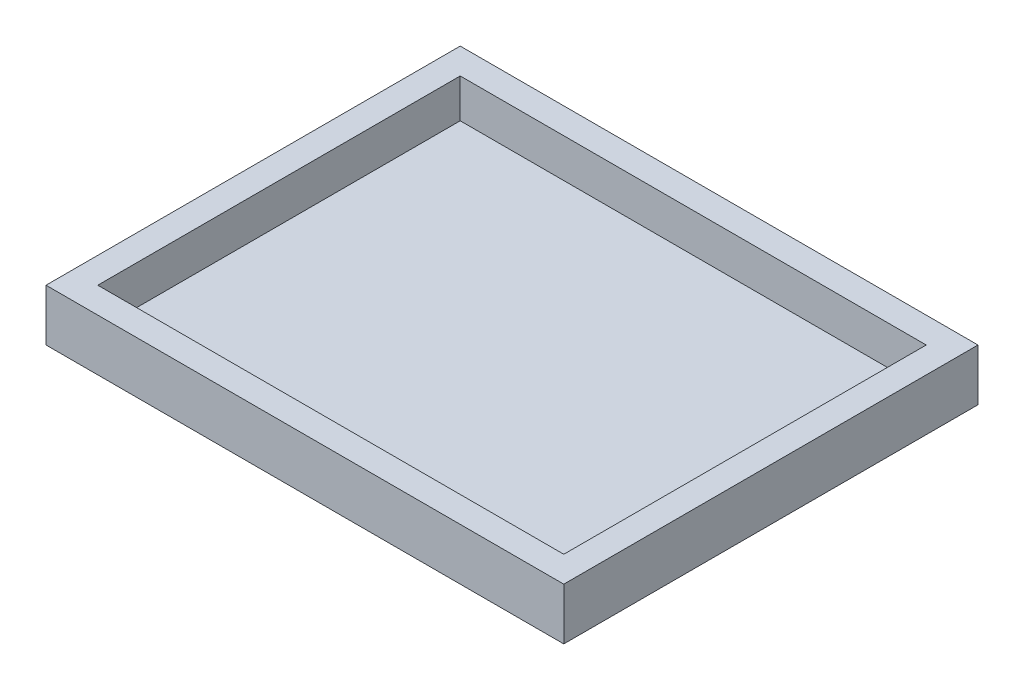
from build123d import *

# Parameters (mm, degrees)
SKETCH1_W           = 100
SKETCH1_H           = 80
SKETCH1_W_2         = 90
SKETCH1_H_2         = 70
BOSS_EXTRUDE1_DEPTH = 10
SKETCH1_2_W         = 90
SKETCH1_2_H         = 70
BOSS_EXTRUDE2_DEPTH = 2.5


with BuildPart() as part:
    # Sketch1 → Boss-Extrude1 (new body)
    with BuildSketch(Plane(origin=(0, 0, 0), x_dir=(1, 0, 0), z_dir=(0, 1, 0))):
        Rectangle(SKETCH1_W, SKETCH1_H)
        Rectangle(SKETCH1_W_2, SKETCH1_H_2, mode=Mode.SUBTRACT)
    extrude(amount=BOSS_EXTRUDE1_DEPTH)

    # Sketch1<2> → Boss-Extrude2 (add)
    with BuildSketch(Plane(origin=(0, 0, 0), x_dir=(1, 0, 0), z_dir=(0, 1, 0))):
        Rectangle(SKETCH1_2_W, SKETCH1_2_H)
    extrude(amount=BOSS_EXTRUDE2_DEPTH)


solid = part.part
